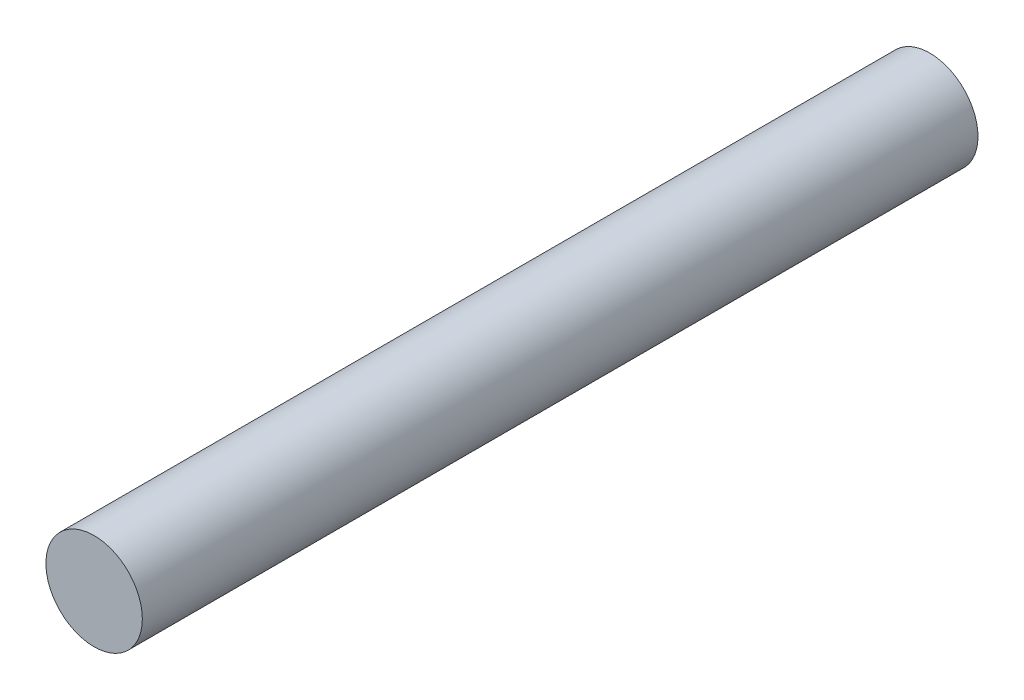
from build123d import *

# Parameters (mm, degrees)
SKETCH_1_R      = 3
EXTRUDE_1_DEPTH = 52


with BuildPart() as part:
    # 草图1 → 凸台-拉伸1 (new body)
    with BuildSketch(Plane.XY):
        Circle(SKETCH_1_R)
    extrude(amount=EXTRUDE_1_DEPTH)


solid = part.part
